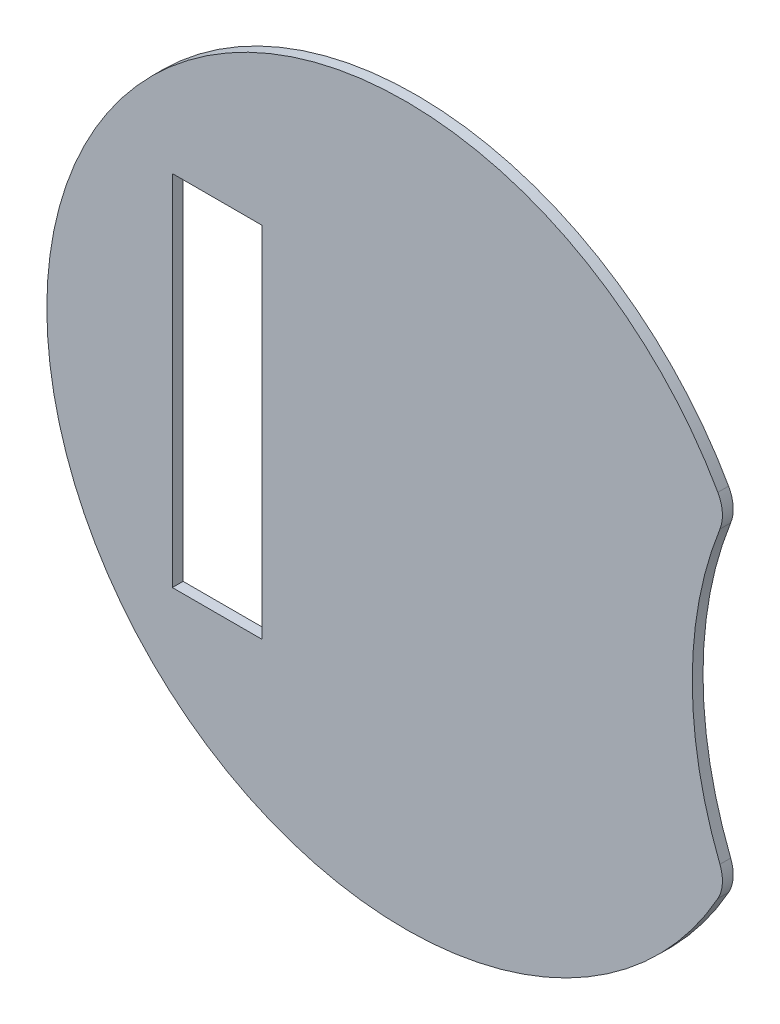
from build123d import *

# Parameters (mm, degrees)
CROQUIS1_R              = 100
SALIENTE_EXTRUIR1_DEPTH = 3
CROQUIS3_R              = 110
CORTAR_EXTRUIR1_DEPTH   = 3
REDONDEO1_R             = 10
CROQUIS4_W              = 25
CROQUIS4_H              = 100
CORTAR_EXTRUIR2_DEPTH   = 142.453172607


with BuildPart() as part:
    # Croquis1 → Saliente-Extruir1 (new body)
    with BuildSketch(Plane.XY):
        Circle(CROQUIS1_R)
    extrude(amount=SALIENTE_EXTRUIR1_DEPTH)

    # Croquis3 → Cortar-Extruir1 (cut)
    with BuildSketch(Plane.XY.offset(3)):
        with Locations((190, 0)):
            Circle(CROQUIS3_R)
    extrude(amount=-CORTAR_EXTRUIR1_DEPTH, mode=Mode.SUBTRACT)

    # Redondeo1
    redondeo1_edges = [part.edges().sort_by_distance(p)[0] for p in [
        (89.473684211, -44.659375654, 1.5),
        (89.473684211, 44.659375654, 1.5),
    ]]
    fillet(redondeo1_edges, radius=REDONDEO1_R)

    # Croquis4 → Cortar-Extruir2 (cut, through all)
    with BuildSketch(Plane(origin=(0, 0, 0), x_dir=(-1, 0, 0), z_dir=(0, 0, -1))):
        with Locations((52.5, 0)):
            Rectangle(CROQUIS4_W, CROQUIS4_H)
    extrude(amount=-CORTAR_EXTRUIR2_DEPTH, mode=Mode.SUBTRACT)


solid = part.part
